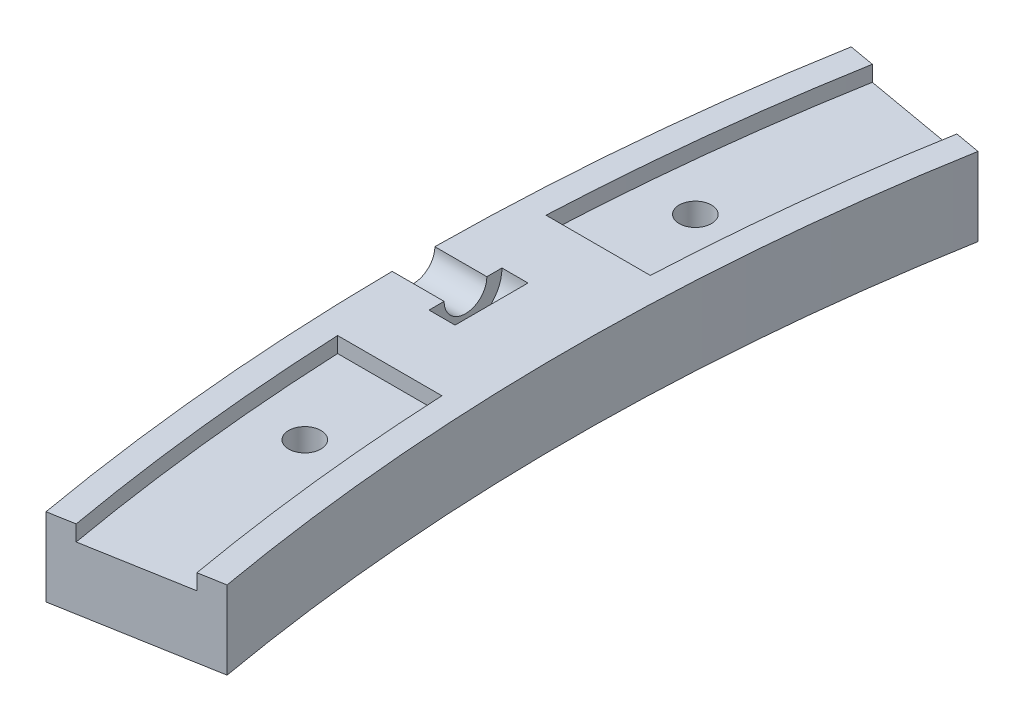
from build123d import *

# Parameters (mm, degrees)
BOSS_EXTRUDE1_DEPTH        = 7.5
CUT_EXTRUDE1_DEPTH         = 1.5
SKETCH4_R                  = 3.5
CUT_EXTRUDE3_DEPTH         = 2.5
SKETCH5_R                  = 2.05
CUT_EXTRUDE4_DEPTH         = 41.774005634
F_3_1_3_1_DIAMETER_HOLE1_D = 3.1


with BuildPart() as part:
    # Sketch1 → Boss-Extrude1 (new body)
    with BuildSketch(Plane(origin=(0, 0, 0), x_dir=(1, 0, 0), z_dir=(0, 1, 0))):
        with BuildLine():
            Line((-219.119725045, 38.636719531), (-204.34760875, 36.031996866))
            ThreePointArc((-204.34760875, 36.031996866), (-207.5, 0), (-204.34760875, -36.031996866))
            Line((-204.34760875, -36.031996866), (-219.119725045, -38.636719531))
            ThreePointArc((-219.119725045, -38.636719531), (-222.5, 0), (-219.119725045, 38.636719531))
        make_face()
    extrude(amount=BOSS_EXTRUDE1_DEPTH)

    # Sketch2 → Cut-Extrude1 (cut)
    with BuildSketch(Plane(origin=(0, 7.5, 0), x_dir=(1, 0, 0), z_dir=(0, 1, 0))):
        with BuildLine():
            Line((-206.809628133, 36.46611731), (-216.657705663, 38.202599087))
            ThreePointArc((-216.657705663, 38.202599087), (-218.670303662, 24.151569236), (-219.772609758, 10))
            Line((-219.772609758, 10), (-209.761769634, 10))
            ThreePointArc((-209.761769634, 10), (-208.70564487, 23.279901188), (-206.809628133, 36.46611731))
        make_face()
        with BuildLine():
            Line((-209.761769634, -10), (-219.772609758, -10))
            ThreePointArc((-219.772609758, -10), (-218.670303662, -24.151569236), (-216.657705663, -38.202599087))
            Line((-216.657705663, -38.202599087), (-206.809628133, -36.46611731))
            ThreePointArc((-206.809628133, -36.46611731), (-208.70564487, -23.279901188), (-209.761769634, -10))
        make_face()
    extrude(amount=-CUT_EXTRUDE1_DEPTH, mode=Mode.SUBTRACT)

    # Sketch4 → Cut-Extrude3 (cut)
    with BuildSketch(Plane(origin=(-215, 0, 0), x_dir=(0, 0, -1), z_dir=(1, 0, 0))):
        with Locations((0, 7.5)):
            Circle(SKETCH4_R)
    extrude(amount=-CUT_EXTRUDE3_DEPTH, mode=Mode.SUBTRACT)

    # Sketch5 → Cut-Extrude4 (cut, through all)
    with BuildSketch(Plane(origin=(-215, 0, 0), x_dir=(0, 0, -1), z_dir=(1, 0, 0))):
        with Locations((0, 7.5)):
            Circle(SKETCH5_R)
    extrude(amount=-CUT_EXTRUDE4_DEPTH, mode=Mode.SUBTRACT)

    # Ø3.1 (3.1) Diameter Hole1 (through all)
    with Locations(Plane(origin=(0, 0, 0), x_dir=(-1, 0, 0), z_dir=(0, -1, 0))):
        with Locations((214.18186009, -18.738484691), (214.18186009, 18.738484691)):
            Hole(F_3_1_3_1_DIAMETER_HOLE1_D / 2)


solid = part.part
